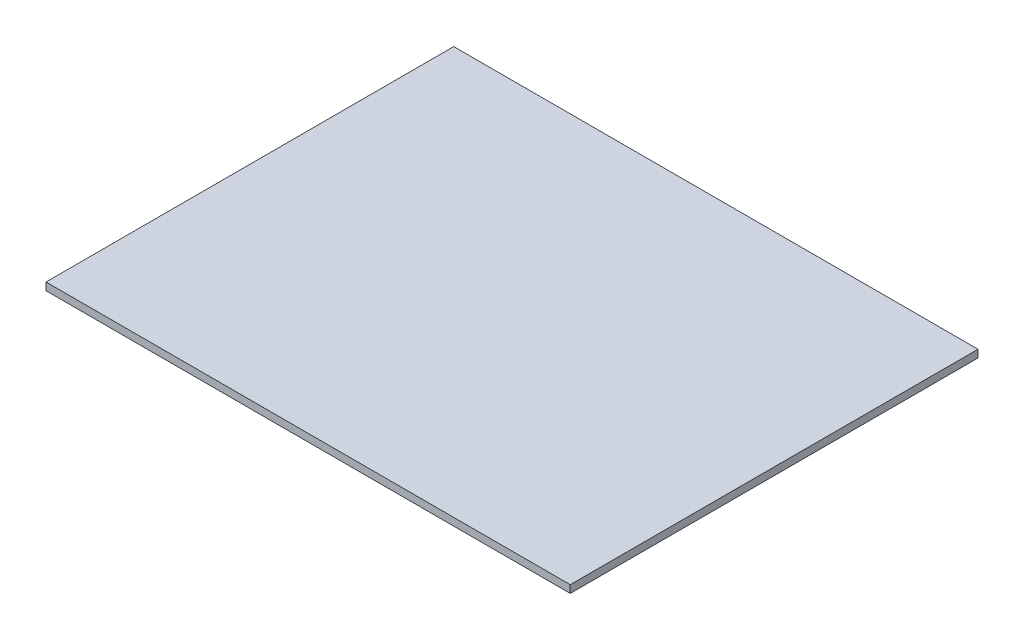
from build123d import *

# Parameters (mm, degrees)
SKETCH1_W           = 45
SKETCH1_H           = 35
BOSS_EXTRUDE1_DEPTH = 0.65


with BuildPart() as part:
    # Sketch1 → Boss-Extrude1 (new body)
    with BuildSketch(Plane(origin=(0, 0, 0), x_dir=(1, 0, 0), z_dir=(0, 1, 0))):
        with Locations((22.5, 17.5)):
            Rectangle(SKETCH1_W, SKETCH1_H)
    extrude(amount=BOSS_EXTRUDE1_DEPTH)


solid = part.part
